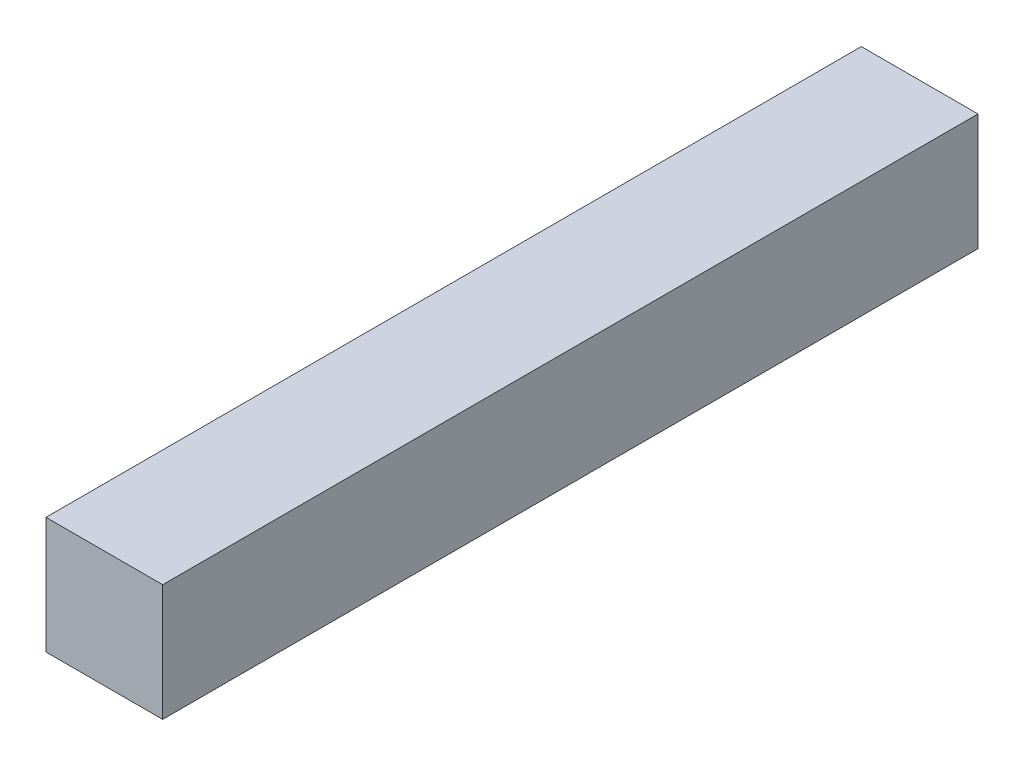
from build123d import *

# Parameters (mm, degrees)
SKETCH1_W           = 15.74
SKETCH1_H           = 15.74
BOSS_EXTRUDE2_DEPTH = 110


with BuildPart() as part:
    # Sketch1 → Boss-Extrude2 (new body)
    with BuildSketch(Plane.XY):
        with Locations((8, 8)):
            Rectangle(SKETCH1_W, SKETCH1_H)
    extrude(amount=BOSS_EXTRUDE2_DEPTH)


solid = part.part
